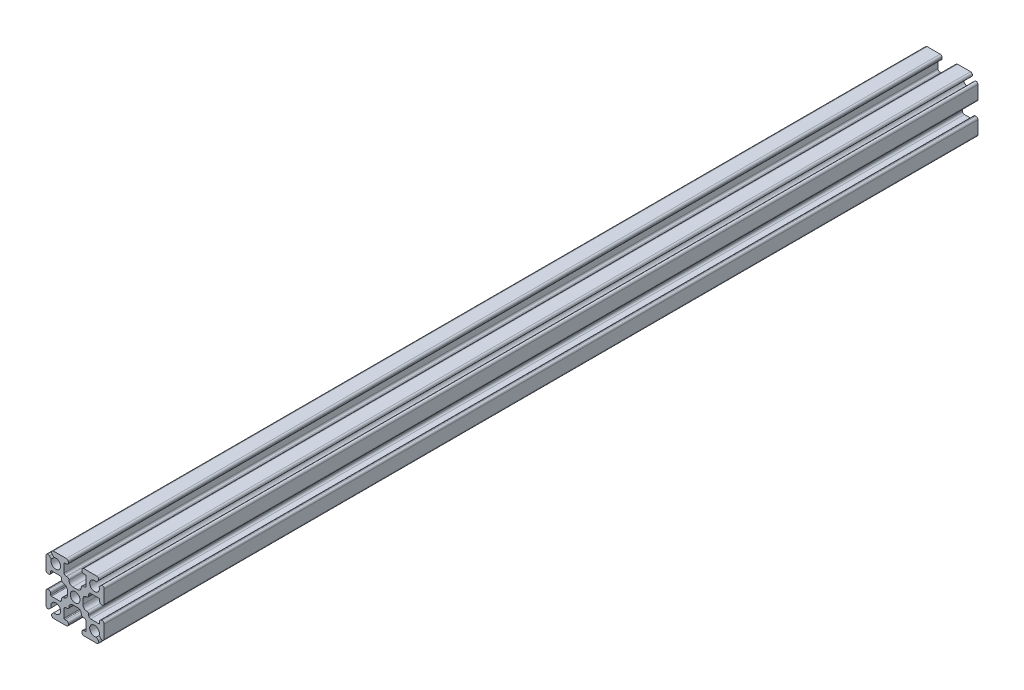
from build123d import *

# Parameters (mm, degrees)
SKETCH1_R           = 1.25
BOSS_EXTRUDE1_DEPTH = 225


with BuildPart() as part:
    # Sketch1 → Boss-Extrude1 (new body)
    with BuildSketch(Plane.XY.offset(225)):
        with BuildLine():
            Line((-5.939339828, 6.646446609), (-5.456539197, 6.163645978))
            ThreePointArc((-5.456539197, 6.163645978), (-4.116116524, 4.116116524), (-6.163645978, 5.456539197))
            Line((-6.163645978, 5.456539197), (-6.646446609, 5.939339828))
            ThreePointArc((-6.646446609, 5.939339828), (-7.191341716, 6.047726204), (-7.5, 5.585786438))
            Line((-7.5, 5.585786438), (-7.5, 2.25))
            ThreePointArc((-7.5, 2.25), (-7.353553391, 1.896446609), (-7, 1.75))
            Line((-7, 1.75), (-6.8, 1.75))
            ThreePointArc((-6.8, 1.75), (-6.446446609, 1.896446609), (-6.3, 2.25))
            Line((-6.3, 2.25), (-6.3, 2.65))
            ThreePointArc((-6.3, 2.65), (-6.241421356, 2.791421356), (-6.1, 2.85))
            Line((-6.1, 2.85), (-4, 2.85))
            ThreePointArc((-4, 2.85), (-3.646446609, 2.703553391), (-3.5, 2.35))
            Line((-3.5, 2.35), (-3.5, 2.1))
            ThreePointArc((-3.5, 2.1), (-3.353553391, 1.746446609), (-3, 1.6))
            ThreePointArc((-3, 1.6), (-2.292893219, 1.307106781), (-2, 0.6))
            Line((-2, 0.6), (-2, -0.6))
            ThreePointArc((-2, -0.6), (-2.292893219, -1.307106781), (-3, -1.6))
            ThreePointArc((-3, -1.6), (-3.353553391, -1.746446609), (-3.5, -2.1))
            Line((-3.5, -2.1), (-3.5, -2.35))
            ThreePointArc((-3.5, -2.35), (-3.646446609, -2.703553391), (-4, -2.85))
            Line((-4, -2.85), (-6.1, -2.85))
            ThreePointArc((-6.1, -2.85), (-6.241421356, -2.791421356), (-6.3, -2.65))
            Line((-6.3, -2.65), (-6.3, -2.25))
            ThreePointArc((-6.3, -2.25), (-6.446446609, -1.896446609), (-6.8, -1.75))
            Line((-6.8, -1.75), (-7, -1.75))
            ThreePointArc((-7, -1.75), (-7.353553391, -1.896446609), (-7.5, -2.25))
            Line((-7.5, -2.25), (-7.5, -5.585786438))
            ThreePointArc((-7.5, -5.585786438), (-7.191341716, -6.047726204), (-6.646446609, -5.939339828))
            Line((-6.646446609, -5.939339828), (-6.163645978, -5.456539197))
            ThreePointArc((-6.163645978, -5.456539197), (-4.116116524, -4.116116524), (-5.456539197, -6.163645978))
            Line((-5.456539197, -6.163645978), (-5.939339828, -6.646446609))
            ThreePointArc((-5.939339828, -6.646446609), (-6.047726204, -7.191341716), (-5.585786438, -7.5))
            Line((-5.585786438, -7.5), (-2.25, -7.5))
            ThreePointArc((-2.25, -7.5), (-1.896446609, -7.353553391), (-1.75, -7))
            Line((-1.75, -7), (-1.75, -6.8))
            ThreePointArc((-1.75, -6.8), (-1.896446609, -6.446446609), (-2.25, -6.3))
            Line((-2.25, -6.3), (-2.65, -6.3))
            ThreePointArc((-2.65, -6.3), (-2.791421356, -6.241421356), (-2.85, -6.1))
            Line((-2.85, -6.1), (-2.85, -4))
            ThreePointArc((-2.85, -4), (-2.703553391, -3.646446609), (-2.35, -3.5))
            Line((-2.35, -3.5), (-2.1, -3.5))
            ThreePointArc((-2.1, -3.5), (-1.746446609, -3.353553391), (-1.6, -3))
            ThreePointArc((-1.6, -3), (-1.307106781, -2.292893219), (-0.6, -2))
            Line((-0.6, -2), (0.6, -2))
            ThreePointArc((0.6, -2), (1.307106781, -2.292893219), (1.6, -3))
            ThreePointArc((1.6, -3), (1.746446609, -3.353553391), (2.1, -3.5))
            Line((2.1, -3.5), (2.35, -3.5))
            ThreePointArc((2.35, -3.5), (2.703553391, -3.646446609), (2.85, -4))
            Line((2.85, -4), (2.85, -6.1))
            ThreePointArc((2.85, -6.1), (2.791421356, -6.241421356), (2.65, -6.3))
            Line((2.65, -6.3), (2.25, -6.3))
            ThreePointArc((2.25, -6.3), (1.896446609, -6.446446609), (1.75, -6.8))
            Line((1.75, -6.8), (1.75, -7))
            ThreePointArc((1.75, -7), (1.896446609, -7.353553391), (2.25, -7.5))
            Line((2.25, -7.5), (5.585786438, -7.5))
            ThreePointArc((5.585786438, -7.5), (6.047726204, -7.191341716), (5.939339828, -6.646446609))
            Line((5.939339828, -6.646446609), (5.456539197, -6.163645978))
            ThreePointArc((5.456539197, -6.163645978), (4.116116524, -4.116116524), (6.163645978, -5.456539197))
            Line((6.163645978, -5.456539197), (6.646446609, -5.939339828))
            ThreePointArc((6.646446609, -5.939339828), (7.191341716, -6.047726204), (7.5, -5.585786438))
            Line((7.5, -5.585786438), (7.5, -2.25))
            ThreePointArc((7.5, -2.25), (7.353553391, -1.896446609), (7, -1.75))
            Line((7, -1.75), (6.8, -1.75))
            ThreePointArc((6.8, -1.75), (6.446446609, -1.896446609), (6.3, -2.25))
            Line((6.3, -2.25), (6.3, -2.65))
            ThreePointArc((6.3, -2.65), (6.241421356, -2.791421356), (6.1, -2.85))
            Line((6.1, -2.85), (4, -2.85))
            ThreePointArc((4, -2.85), (3.646446609, -2.703553391), (3.5, -2.35))
            Line((3.5, -2.35), (3.5, -2.1))
            ThreePointArc((3.5, -2.1), (3.353553391, -1.746446609), (3, -1.6))
            ThreePointArc((3, -1.6), (2.292893219, -1.307106781), (2, -0.6))
            Line((2, -0.6), (2, 0.6))
            ThreePointArc((2, 0.6), (2.292893219, 1.307106781), (3, 1.6))
            ThreePointArc((3, 1.6), (3.353553391, 1.746446609), (3.5, 2.1))
            Line((3.5, 2.1), (3.5, 2.35))
            ThreePointArc((3.5, 2.35), (3.646446609, 2.703553391), (4, 2.85))
            Line((4, 2.85), (6.1, 2.85))
            ThreePointArc((6.1, 2.85), (6.241421356, 2.791421356), (6.3, 2.65))
            Line((6.3, 2.65), (6.3, 2.25))
            ThreePointArc((6.3, 2.25), (6.446446609, 1.896446609), (6.8, 1.75))
            Line((6.8, 1.75), (7, 1.75))
            ThreePointArc((7, 1.75), (7.353553391, 1.896446609), (7.5, 2.25))
            Line((7.5, 2.25), (7.5, 5.585786438))
            ThreePointArc((7.5, 5.585786438), (7.191341716, 6.047726204), (6.646446609, 5.939339828))
            Line((6.646446609, 5.939339828), (6.163645978, 5.456539197))
            ThreePointArc((6.163645978, 5.456539197), (4.116116524, 4.116116524), (5.456539197, 6.163645978))
            Line((5.456539197, 6.163645978), (5.939339828, 6.646446609))
            ThreePointArc((5.939339828, 6.646446609), (6.047726204, 7.191341716), (5.585786438, 7.5))
            Line((5.585786438, 7.5), (2.25, 7.5))
            ThreePointArc((2.25, 7.5), (1.896446609, 7.353553391), (1.75, 7))
            Line((1.75, 7), (1.75, 6.8))
            ThreePointArc((1.75, 6.8), (1.896446609, 6.446446609), (2.25, 6.3))
            Line((2.25, 6.3), (2.65, 6.3))
            ThreePointArc((2.65, 6.3), (2.791421356, 6.241421356), (2.85, 6.1))
            Line((2.85, 6.1), (2.85, 4))
            ThreePointArc((2.85, 4), (2.703553391, 3.646446609), (2.35, 3.5))
            Line((2.35, 3.5), (2.1, 3.5))
            ThreePointArc((2.1, 3.5), (1.746446609, 3.353553391), (1.6, 3))
            ThreePointArc((1.6, 3), (1.307106781, 2.292893219), (0.6, 2))
            Line((0.6, 2), (-0.6, 2))
            ThreePointArc((-0.6, 2), (-1.307106781, 2.292893219), (-1.6, 3))
            ThreePointArc((-1.6, 3), (-1.746446609, 3.353553391), (-2.1, 3.5))
            Line((-2.1, 3.5), (-2.35, 3.5))
            ThreePointArc((-2.35, 3.5), (-2.703553391, 3.646446609), (-2.85, 4))
            Line((-2.85, 4), (-2.85, 6.1))
            ThreePointArc((-2.85, 6.1), (-2.791421356, 6.241421356), (-2.65, 6.3))
            Line((-2.65, 6.3), (-2.25, 6.3))
            ThreePointArc((-2.25, 6.3), (-1.896446609, 6.446446609), (-1.75, 6.8))
            Line((-1.75, 6.8), (-1.75, 7))
            ThreePointArc((-1.75, 7), (-1.896446609, 7.353553391), (-2.25, 7.5))
            Line((-2.25, 7.5), (-5.585786438, 7.5))
            ThreePointArc((-5.585786438, 7.5), (-6.047726204, 7.191341716), (-5.939339828, 6.646446609))
        make_face()
        with Locations(Location((0, 0, 0), (0, 0, 180))):
            Circle(SKETCH1_R, mode=Mode.SUBTRACT)
    extrude(amount=-BOSS_EXTRUDE1_DEPTH)


solid = part.part
